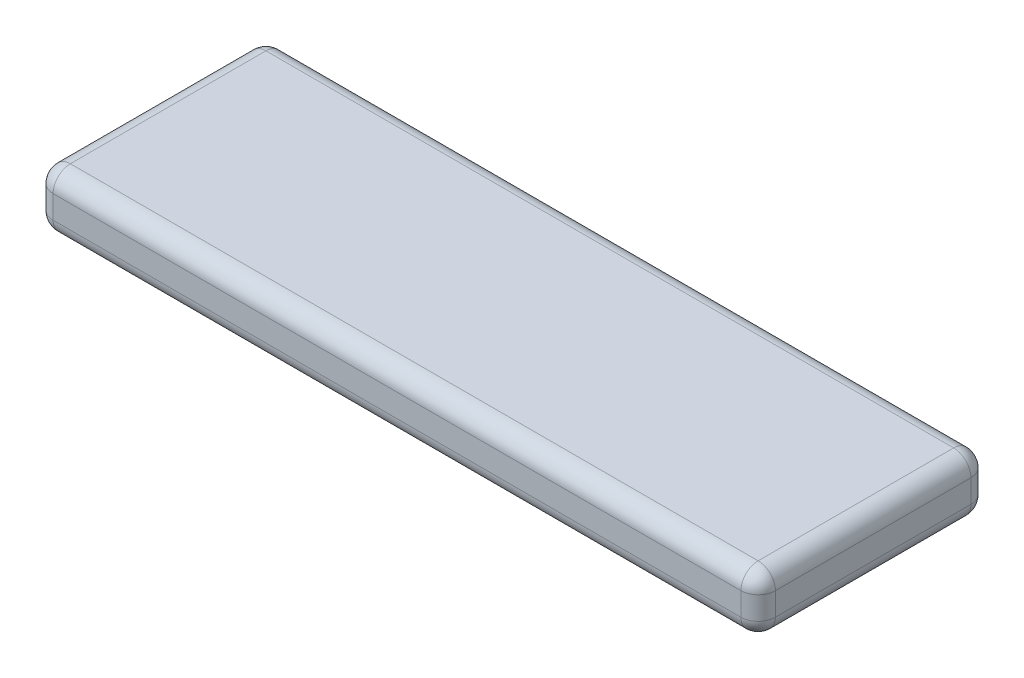
from build123d import *

# Parameters (mm, degrees)
SKETCH1_W           = 1256
SKETCH1_H           = 400
BOSS_EXTRUDE1_DEPTH = 100
FILLET1_R           = 30


with BuildPart() as part:
    # Sketch1 → Boss-Extrude1 (new body)
    with BuildSketch(Plane(origin=(0, 0, 0), x_dir=(1, 0, 0), z_dir=(0, 1, 0))):
        with Locations((628, 200)):
            Rectangle(SKETCH1_W, SKETCH1_H)
    extrude(amount=BOSS_EXTRUDE1_DEPTH)

    # Fillet1
    fillet1_edges = [part.edges().sort_by_distance(p)[0] for p in [
        (1256, 100, -200),
        (628, 100, -400),
        (0, 100, -200),
        (628, 0, -400),
        (1256, 0, -200),
        (628, 0, 0),
        (0, 0, -200),
        (0, 50, -400),
        (1256, 50, -400),
        (1256, 50, 0),
        (0, 50, 0),
        (628, 100, 0),
    ]]
    fillet(fillet1_edges, radius=FILLET1_R)


solid = part.part
